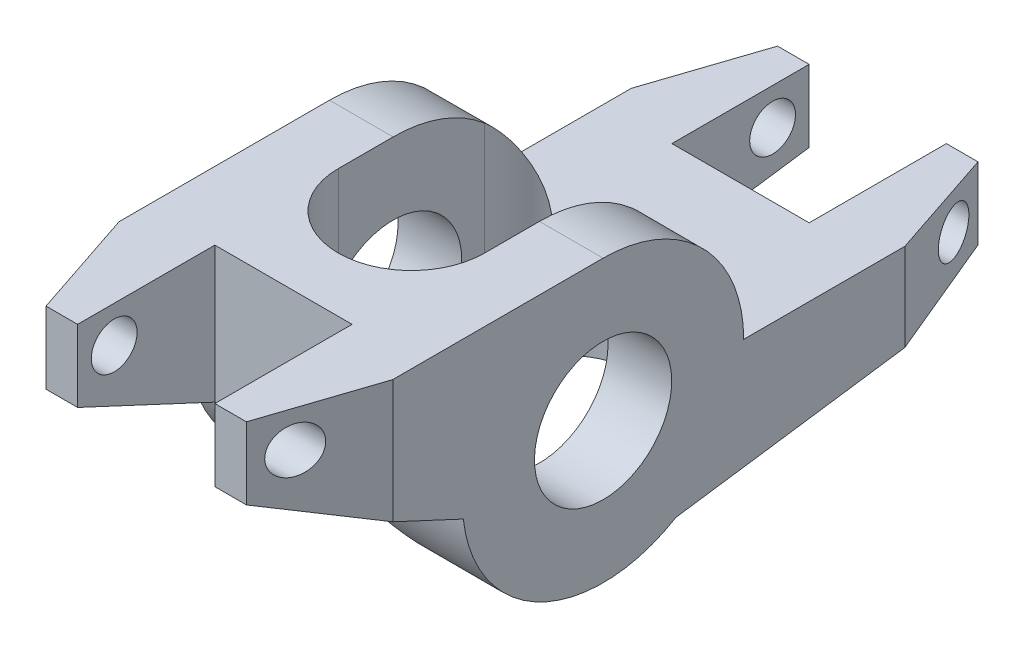
from build123d import *
from OCP.BRepFilletAPI import BRepFilletAPI_MakeChamfer

# Parameters (mm, degrees)
SKETCH1_R           = 4.765
BOSS_EXTRUDE1_DEPTH = 9.5
CHAMFER1_SIZE       = 2.54
CHAMFER1_SIZE2      = 7.62
CHAMFER2_SIZE       = 7.62
CHAMFER2_SIZE2      = 2.54
CUT_EXTRUDE1_DEPTH  = 17.5
SKETCH3_W           = 9.53
SKETCH3_H           = 9.53
CUT_EXTRUDE2_DEPTH  = 17.5
SKETCH4_R           = 1.59
CUT_EXTRUDE3_DEPTH  = 17.5


with BuildPart() as part:
    # Sketch1 → Boss-Extrude1 (new, symmetric)
    with BuildSketch(Plane(origin=(0, 0, 0), x_dir=(0, 0, -1), z_dir=(1, 0, 0))):
        with BuildLine():
            Line((0, 9.765), (-22.225, 9.765))
            Line((-22.225, 9.765), (-22.225, 4.765))
            Line((-22.225, 4.765), (-9.705896356, -1.072753903))
            ThreePointArc((-9.705896356, -1.072753903), (-4.321191132, -8.756856297), (5.053224579, -8.355845041))
            Line((5.053224579, -8.355845041), (28.575, -5))
            Line((28.575, -5), (28.575, 0))
            Line((28.575, 0), (9.765, 0))
            ThreePointArc((9.765, 0), (6.904897718, 6.904897718), (0, 9.765))
        make_face()
        Circle(SKETCH1_R, mode=Mode.SUBTRACT)
    extrude(amount=BOSS_EXTRUDE1_DEPTH, both=True)

    # Chamfer1: one chamfer whose edges measure the first distance from different faces: ONE call of the kernel's chamfer builder (chamfer() names one face for all edges)
    chamfer1_edges_1 = [part.edges().sort_by_distance(p)[0] for p in [
        (9.5, 7.265, 22.225),
    ]]
    chamfer1_side_1 = [part.faces().sort_by_distance(p)[0] for p in [
        (0, 7.265, 22.225),
    ]]
    chamfer1_edges_2 = [part.edges().sort_by_distance(p)[0] for p in [
        (9.5, -2.5, -28.575),
    ]]
    chamfer1_side_2 = [part.faces().sort_by_distance(p)[0] for p in [
        (0, -2.5, -28.575),
    ]]
    chamfer1 = BRepFilletAPI_MakeChamfer(part.part.solid().wrapped)
    for e in chamfer1_edges_1:
        chamfer1.Add(CHAMFER1_SIZE, CHAMFER1_SIZE2, e.wrapped, chamfer1_side_1[0].wrapped)  # the first distance lies on this face
    for e in chamfer1_edges_2:
        chamfer1.Add(CHAMFER1_SIZE, CHAMFER1_SIZE2, e.wrapped, chamfer1_side_2[0].wrapped)  # the first distance lies on this face
    add(Compound.cast(chamfer1.Shape()), mode=Mode.REPLACE)

    # Chamfer2
    chamfer2_edges = [part.edges().sort_by_distance(p)[0] for p in [
        (-9.5, 7.265, 22.225),
        (-9.5, -2.5, -28.575),
    ]]
    chamfer2_side = [part.faces().sort_by_distance(p)[0] for p in [
        (-9.5, 9.220751812, 11.1125),
    ]]
    chamfer(chamfer2_edges, length=CHAMFER2_SIZE, length2=CHAMFER2_SIZE2, reference=chamfer2_side[0])

    # Sketch2 → Cut-Extrude1 (cut, symmetric)
    with BuildSketch(Plane(origin=(0, 0, 0), x_dir=(1, 0, 0), z_dir=(0, 1, 0))):
        with BuildLine():
            Line((-5.08, -3.81), (-5.08, 6.35))
            ThreePointArc((-5.08, 6.35), (0, 11.43), (5.08, 6.35))
            Line((5.08, 6.35), (5.08, -3.81))
            ThreePointArc((5.08, -3.81), (0, -8.89), (-5.08, -3.81))
        make_face()
    extrude(amount=CUT_EXTRUDE1_DEPTH, both=True, mode=Mode.SUBTRACT)

    # Sketch3 → Cut-Extrude2 (cut, symmetric)
    with BuildSketch(Plane(origin=(0, 0, 0), x_dir=(1, 0, 0), z_dir=(0, 1, 0))):
        with Locations((0, 23.81)):
            Rectangle(SKETCH3_W, SKETCH3_H)
        with Locations((0, -17.46)):
            Rectangle(SKETCH3_W, SKETCH3_H)
    extrude(amount=CUT_EXTRUDE2_DEPTH, both=True, mode=Mode.SUBTRACT)

    # Sketch4 → Cut-Extrude3 (cut, symmetric)
    with BuildSketch(Plane(origin=(0, 0, 0), x_dir=(0, 0, -1), z_dir=(1, 0, 0))):
        with Locations((26.035, -2.54)):
            Circle(SKETCH4_R)
        with Locations(Location((-19.685, 7.225, 0), (0, 0, 180))):
            Circle(SKETCH4_R)
    extrude(amount=CUT_EXTRUDE3_DEPTH, both=True, mode=Mode.SUBTRACT)


solid = part.part
